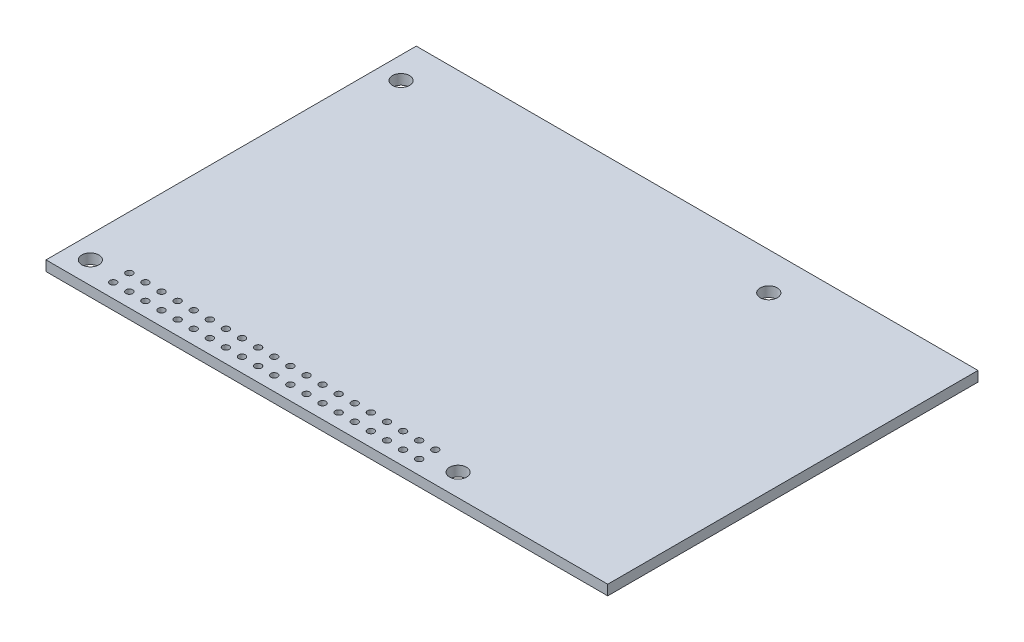
from build123d import *

# Parameters (mm, degrees)
SKETCH1_W                      = 88.6
SKETCH1_H                      = 58.4
BOSS_EXTRUDE1_DEPTH            = 1.6
F_2_7_2_7_DIAMETER_HOLE1_D     = 2.7
F_2_7_2_7_DIAMETER_HOLE1_DEPTH = 5.1
F_2_7_2_7_DIAMETER_HOLE1_TIP   = 0.811161836
LPATTERN1_COUNT                = 20
LPATTERN1_PITCH                = 2.54
LPATTERN1_COUNT_DIR2           = 2
LPATTERN1_PITCH_DIR2           = 2.54


with BuildPart() as part:
    # Sketch1 → Boss-Extrude1 (new body)
    with BuildSketch(Plane(origin=(0, 0, 0), x_dir=(1, 0, 0), z_dir=(0, 1, 0))):
        with Locations((11.8, 25.7)):
            Rectangle(SKETCH1_W, SKETCH1_H)
    extrude(amount=BOSS_EXTRUDE1_DEPTH)

    # Ø2.7 (2.7) Diameter Hole1
    with Locations(Plane(origin=(-29, 1.6, -49), x_dir=(0, 0, 1), z_dir=(0, 1, 0))):
        with Locations((0, 0), (0, 58), (49, 58), (49, 0)):
            Hole(F_2_7_2_7_DIAMETER_HOLE1_D / 2, depth=F_2_7_2_7_DIAMETER_HOLE1_DEPTH)
            with Locations((0, 0, -(F_2_7_2_7_DIAMETER_HOLE1_DEPTH + F_2_7_2_7_DIAMETER_HOLE1_TIP / 2))):  # 118° drill point
                Cone(0, F_2_7_2_7_DIAMETER_HOLE1_D / 2, F_2_7_2_7_DIAMETER_HOLE1_TIP, mode=Mode.SUBTRACT)

    # Sketch3 → Ø1.05 (1.05) Diameter Hole1 (revolve, cut)
    with BuildSketch(Plane(origin=(-24.13, 1.6, 1.27), x_dir=(0, 0, 1), z_dir=(1, 0, 0))):
        Polygon((0, 0), (0, 5.415451825), (0.525, 5.1), (0.525, 0), align=None)
    f_1_05_1_05_diameter_hole1 = revolve(axis=Axis((-24.13, 7.95, 1.27), (0, -1, 0)), mode=Mode.SUBTRACT)

    # LPattern1: 1.05 _1.05_ Diameter Hole1 20 × 2
    with Locations(*[(i * LPATTERN1_PITCH, 0, -j * LPATTERN1_PITCH_DIR2) for i in range(LPATTERN1_COUNT) for j in range(LPATTERN1_COUNT_DIR2) if (i, j) != (0, 0)]):
        add(f_1_05_1_05_diameter_hole1, mode=Mode.SUBTRACT)


solid = part.part
